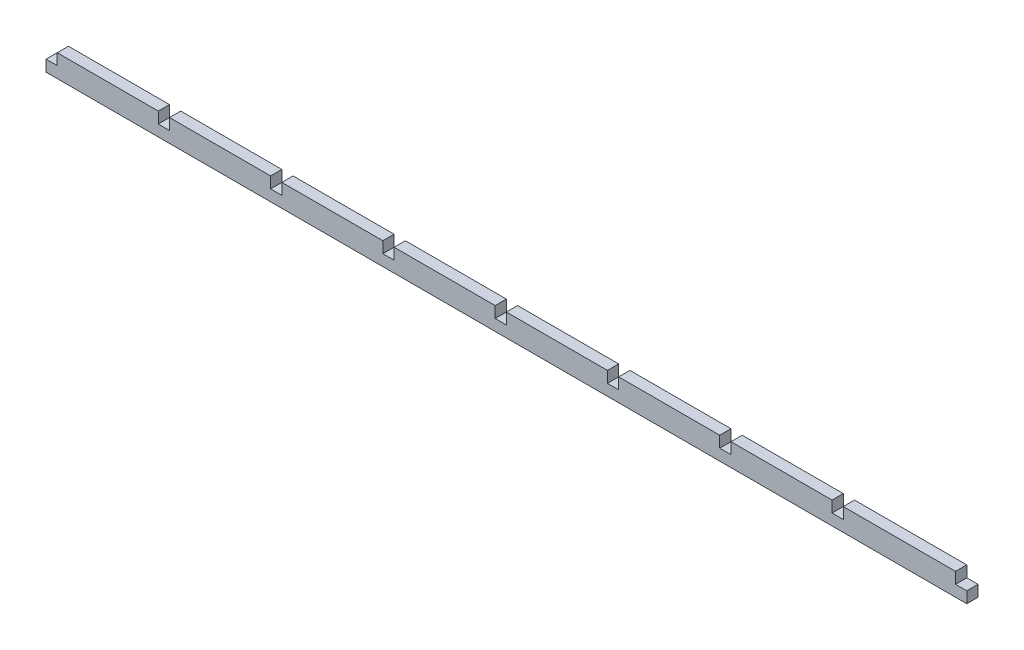
from build123d import *

# Parameters (mm, degrees)
BOSS_EXTRUDE1_DEPTH = 3


with BuildPart() as part:
    # Sketch1 → Boss-Extrude1 (new body)
    with BuildSketch(Plane.XY):
        Polygon((-159.113112534, 58.761697125), (-132.113112534, 58.761697125), (-132.113112534, 55.761697125), (-129.113112534, 55.761697125), (-129.113112534, 58.761697125), (-102.113112534, 58.761697125), (-102.113112534, 55.761697125), (-99.113112534, 55.761697125), (-99.113112534, 58.761697125), (-72.113112534, 58.761697125), (-72.113112534, 55.761697125), (-69.113112534, 55.761697125), (-69.113112534, 58.761697125), (-42.113112534, 58.761697125), (-42.113112534, 55.761697125), (-39.113112534, 55.761697125), (-39.113112534, 58.761697125), (-12.113112534, 58.761697125), (-12.113112534, 55.761697125), (-9.113112534, 55.761697125), (-9.113112534, 58.761697125), (17.886887466, 58.761697125), (17.886887466, 55.761697125), (20.886887466, 55.761697125), (20.886887466, 58.761697125), (47.886887466, 58.761697125), (47.886887466, 55.761697125), (50.886887466, 55.761697125), (50.886887466, 58.761697125), (80.886887466, 58.761697125), (80.886887466, 55.761697125), (83.886887466, 55.761697125), (83.886887466, 52.761697125), (80.886887466, 52.761697125), (-159.113112534, 52.761697125), (-162.113112534, 52.761697125), (-162.113112534, 55.761697125), (-159.113112534, 55.761697125), align=None)
    extrude(amount=BOSS_EXTRUDE1_DEPTH)


solid = part.part
